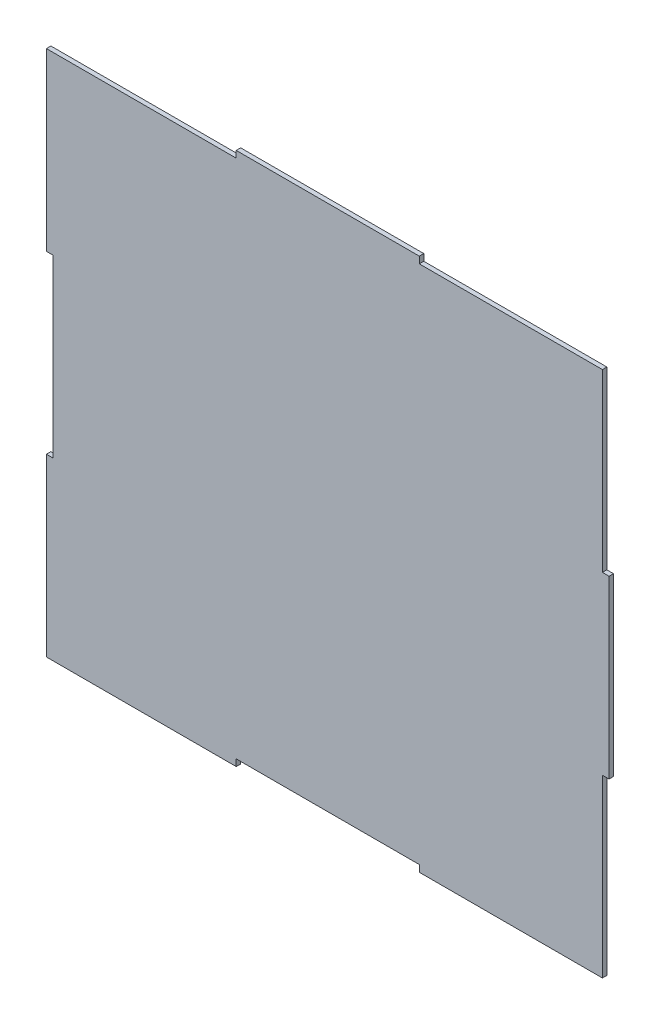
from build123d import *

# Parameters (mm, degrees)
BOSS_EXTRUDE1_DEPTH = 2


with BuildPart() as part:
    # Sketch1 → Boss-Extrude1 (new body)
    with BuildSketch(Plane.XY):
        Polygon((41, -118), (123, -118), (123, -39.333333333), (126, -39.333333333), (126, 39.333333333), (123, 39.333333333), (123, 118), (41, 118), (41, 121), (-41, 121), (-41, 118), (-123, 118), (-126, 118), (-126, 39.333333333), (-123, 39.333333333), (-123, -39.333333333), (-126, -39.333333333), (-126, -118), (-123, -118), (-41, -118), (-41, -115), (41, -115), align=None)
    extrude(amount=BOSS_EXTRUDE1_DEPTH)


solid = part.part
